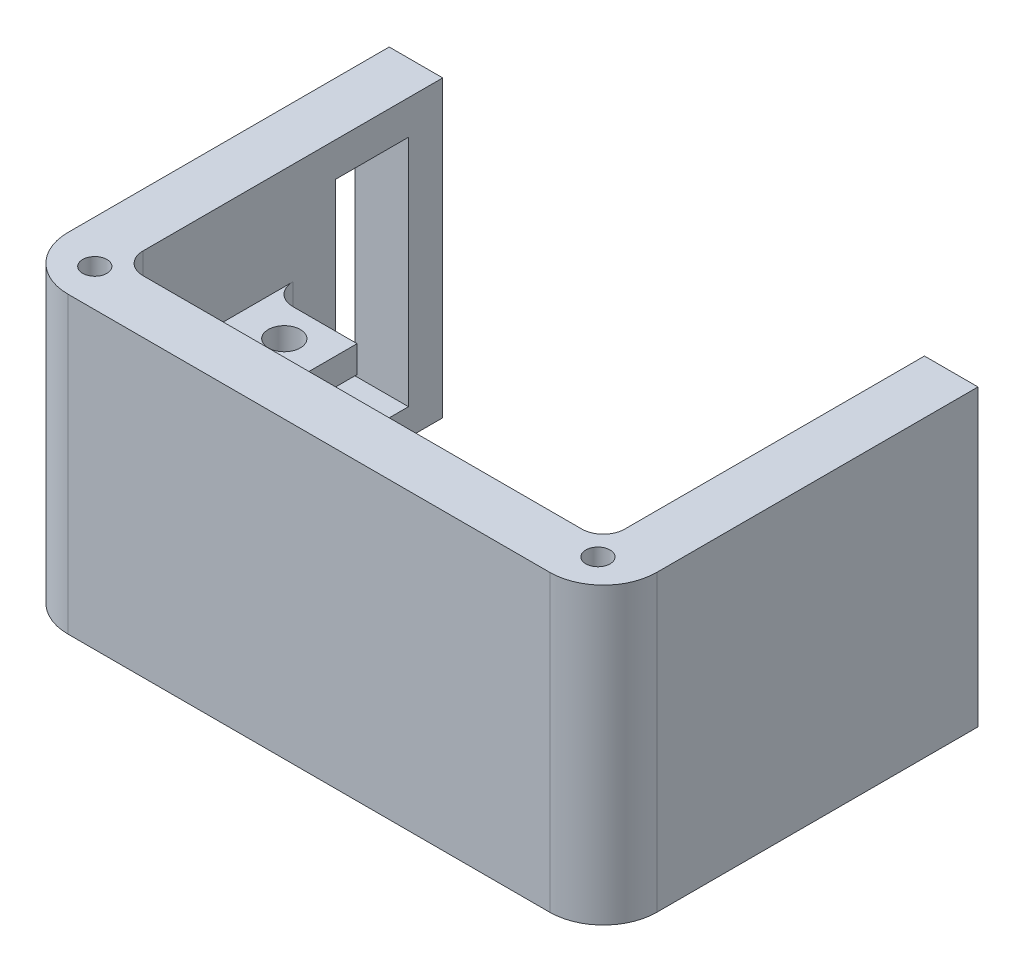
from build123d import *

# Parameters (mm, degrees)
BOSS_EXTRUDE1_DEPTH       = 31.75
SKETCH5_W                 = 7.62
SKETCH5_H                 = 3.175
BOSS_EXTRUDE2_DEPTH       = 10.16
F_6_CLEARANCE_HOLE1_D     = 3.7973
BOSS_EXTRUDE3_DEPTH       = 3.175
FILLET1_R                 = 6.35
FILLET2_R                 = 2.54
FILLET3_R                 = 2.54
FILLET4_R                 = 2.54
F_6_40_TAPPED_HOLE1_D     = 2.8702
F_6_40_TAPPED_HOLE1_DEPTH = 38.1
F_6_40_TAPPED_HOLE1_TIP   = 0.862295074
BOSS_EXTRUDE5_DEPTH       = 6.35


with BuildPart() as part:
    # Sketch1 → Boss-Extrude1 (new body)
    with BuildSketch(Plane(origin=(0, 0, 0), x_dir=(1, 0, 0), z_dir=(0, 1, 0))):
        Polygon((-34.925, -15.875), (34.925, -15.875), (34.925, 15.875), (34.925, 28.575), (28.575, 28.575), (28.575, 15.875), (28.575, -9.525), (-28.575, -9.525), (-28.575, 15.875), (-34.925, 15.875), align=None)
    extrude(amount=BOSS_EXTRUDE1_DEPTH)

    # Sketch5 → Boss-Extrude2 (add)
    with BuildSketch(Plane(origin=(-28.575, 0, 0), x_dir=(0, 0, -1), z_dir=(1, 0, 0))):
        with Locations((4.445, 18.0975)):
            Rectangle(SKETCH5_W, SKETCH5_H)
    boss_extrude2 = extrude(amount=BOSS_EXTRUDE2_DEPTH)

    # #6 Clearance Hole1 (through all)
    with Locations(Plane(origin=(0, 19.685, 0), x_dir=(1, 0, 0), z_dir=(0, 1, 0))):
        with Locations((-23.241, 4.445)):
            f_6_clearance_hole1 = Hole(F_6_CLEARANCE_HOLE1_D / 2)

    # Mirror4: Boss-Extrude2, #6 Clearance Hole1 across plane
    add(boss_extrude2.mirror(Plane(origin=(0, 0, 0), x_dir=(0, 0, 1), z_dir=(1, 0, 0))))
    add(f_6_clearance_hole1.mirror(Plane(origin=(0, 0, 0), x_dir=(0, 0, 1), z_dir=(1, 0, 0))), mode=Mode.SUBTRACT)

    # Sketch11 → Boss-Extrude3 (add)
    with BuildSketch(Plane.XZ):
        Polygon((-28.575, -28.575), (-28.575, 9.525), (28.575, 9.525), (28.575, -28.575), (34.925, -28.575), (34.925, 15.875), (-34.925, 15.875), (-34.925, -28.575), align=None)
    extrude(amount=BOSS_EXTRUDE3_DEPTH)

    # Fillet1
    fillet1_edges = [part.edges().sort_by_distance(p)[0] for p in [
        (34.925, 14.2875, 15.875),
        (-34.925, 14.2875, 15.875),
    ]]
    fillet(fillet1_edges, radius=FILLET1_R)

    # Fillet2
    fillet2_edges = [part.edges().sort_by_distance(p)[0] for p in [
        (-28.575, 18.0975, -8.255),
        (-28.575, 18.0975, -0.635),
        (28.575, 18.0975, -0.635),
        (28.575, 18.0975, -8.255),
    ]]
    fillet(fillet2_edges, radius=FILLET2_R)

    # Fillet3
    fillet3_edges = [part.edges().sort_by_distance(p)[0] for p in [
        (-28.575, 16.51, -4.445),
        (28.575, 16.51, -4.445),
    ]]
    fillet(fillet3_edges, radius=FILLET3_R)

    # Fillet4
    fillet4_edges = [part.edges().sort_by_distance(p)[0] for p in [
        (-28.575, 14.2875, 9.525),
        (28.575, 14.2875, 9.525),
    ]]
    fillet(fillet4_edges, radius=FILLET4_R)

    # #6-40 Tapped Hole1
    with Locations(Plane(origin=(0, 31.75, 0), x_dir=(1, 0, 0), z_dir=(0, 1, 0))):
        with Locations((29.845, -11.43), (-29.845, -11.43)):
            Hole(F_6_40_TAPPED_HOLE1_D / 2, depth=F_6_40_TAPPED_HOLE1_DEPTH)
            with Locations((0, 0, -(F_6_40_TAPPED_HOLE1_DEPTH + F_6_40_TAPPED_HOLE1_TIP / 2))):  # 118° drill point
                Cone(0, F_6_40_TAPPED_HOLE1_D / 2, F_6_40_TAPPED_HOLE1_TIP, mode=Mode.SUBTRACT)

    # Sketch17 → Boss-Extrude5 (add)
    with BuildSketch(Plane.ZY.offset(34.925)):
        Polygon((-28.575, 0), (-28.575, 31.75), (-15.875, 31.75), (-15.875, 27.686), (-24.511, 27.686), (-24.511, 0), align=None)
    extrude(amount=-BOSS_EXTRUDE5_DEPTH)


solid = part.part
